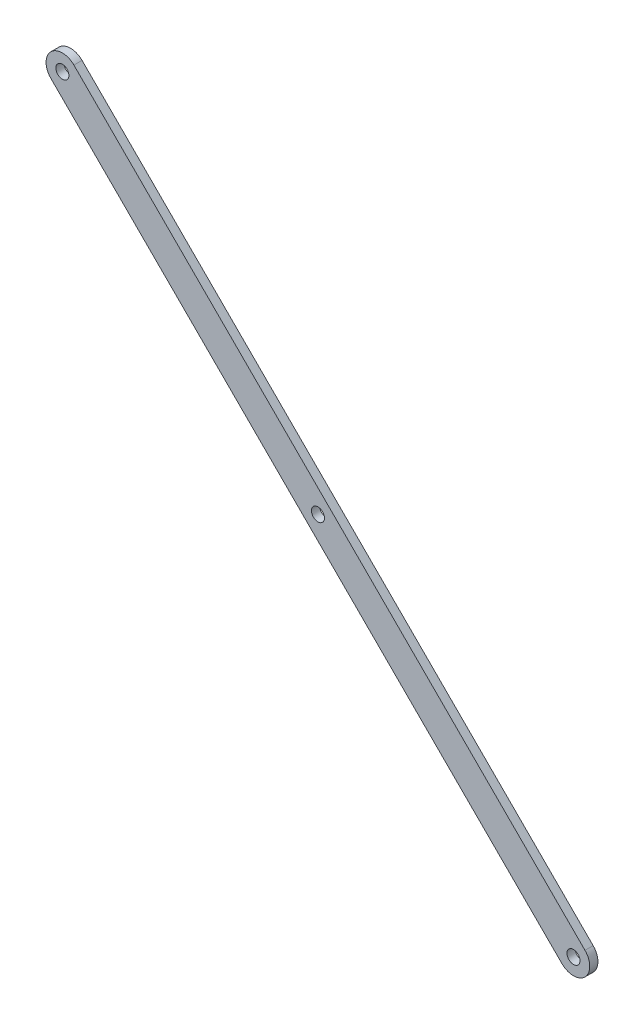
from build123d import *

# Parameters (mm, degrees)
CROQUIS2_R              = 4
SALIENTE_EXTRUIR1_DEPTH = 5


with BuildPart() as part:
    # Croquis2 → Saliente-Extruir1 (new body)
    with BuildSketch(Plane.XY):
        with BuildLine():
            Line((-7.071067812, -7.071067812), (-320.743635946, 306.601500322))
            ThreePointArc((-320.743635946, 306.601500322), (-320.743635946, 320.743635946), (-306.601500322, 320.743635946))
            Line((-306.601500322, 320.743635946), (7.071067812, 7.071067812))
            ThreePointArc((7.071067812, 7.071067812), (7.071067812, -7.071067812), (-7.071067812, -7.071067812))
        make_face()
        with Locations((-313.672568134, 313.672568134)):
            Circle(CROQUIS2_R, mode=Mode.SUBTRACT)
        Circle(CROQUIS2_R, mode=Mode.SUBTRACT)
        with Locations((-156.836284067, 156.836284067)):
            Circle(CROQUIS2_R, mode=Mode.SUBTRACT)
    extrude(amount=SALIENTE_EXTRUIR1_DEPTH)


solid = part.part
